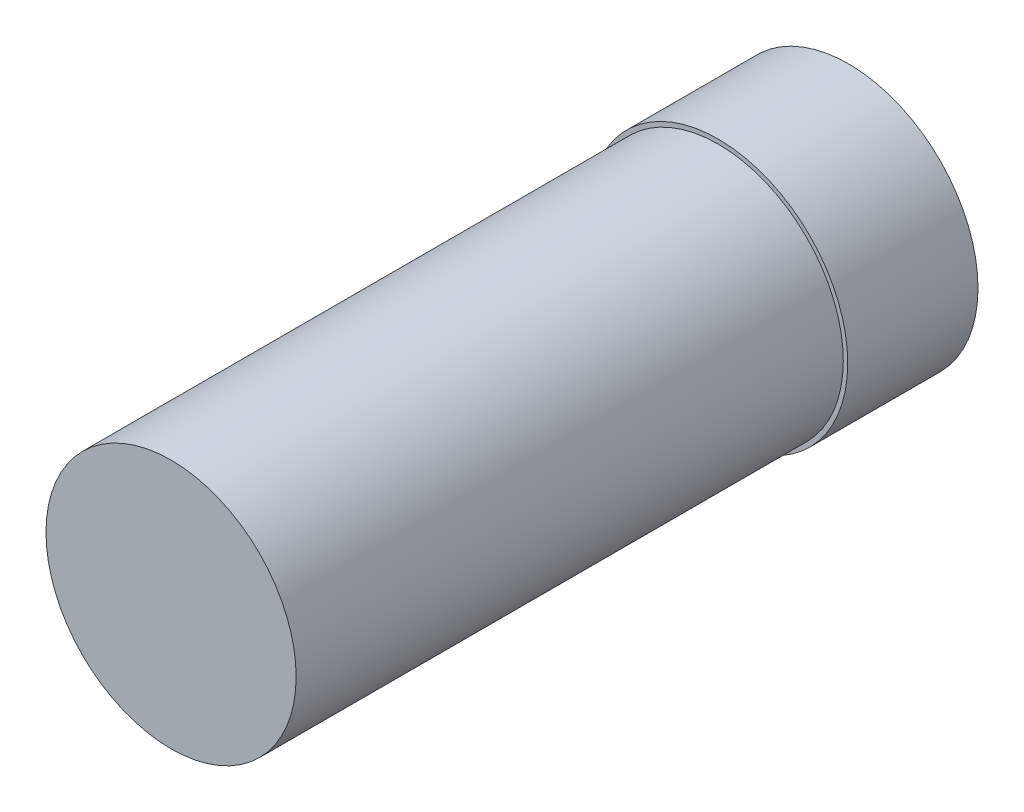
from build123d import *

# Parameters (mm, degrees)
SKETCH_1_R      = 2.485
EXTRUDE_1_DEPTH = 2.5
SKETCH_2_R      = 2.4
EXTRUDE_2_DEPTH = 10.5


with BuildPart() as part:
    # 스케치1 → 보스-돌출1 (new body)
    with BuildSketch(Plane.XY):
        Circle(SKETCH_1_R)
    extrude(amount=EXTRUDE_1_DEPTH)

    # 스케치2 → 보스-돌출2 (add)
    with BuildSketch(Plane.XY.offset(2.5)):
        with Locations(Location((0, 0, 0), (0, 0, 180))):
            Circle(SKETCH_2_R)
    extrude(amount=EXTRUDE_2_DEPTH)


solid = part.part
